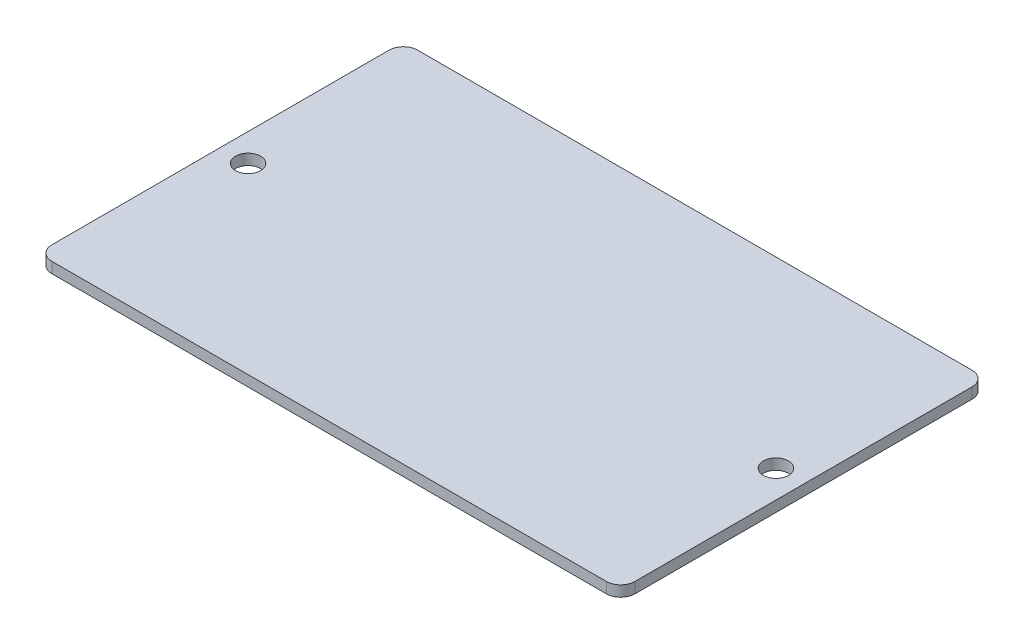
from build123d import *

# Parameters (mm, degrees)
SKETCH1_W               = 81.3
SKETCH1_H               = 51
BOSS_EXTRUDE1_DEPTH     = 1.5
FILLET1_R               = 2
CUT_EXTRUDE1_DEPTH      = 96.984061177
CUT_EXTRUDE1_DEPTH_BACK = 96.984061177
SKETCH2_R               = 1.75


with BuildPart() as part:
    # Sketch1 → Boss-Extrude1 (new body)
    with BuildSketch(Plane(origin=(0, 0, 0), x_dir=(1, 0, 0), z_dir=(0, 1, 0))):
        with Locations((40.65, 25.5)):
            Rectangle(SKETCH1_W, SKETCH1_H)
    extrude(amount=BOSS_EXTRUDE1_DEPTH)

    # Fillet1
    fillet1_edges = [part.edges().sort_by_distance(p)[0] for p in [
        (0, 0.75, -51),
        (81.3, 0.75, -51),
        (81.3, 0.75, 0),
        (0, 0.75, 0),
    ]]
    fillet(fillet1_edges, radius=FILLET1_R)

    # Sketch2 → Cut-Extrude1 (cut, two sides: drawn at the far end of the back side and taken through both)
    with BuildSketch(Plane(origin=(0, 1.5, 0), x_dir=(1, 0, 0), z_dir=(0, 1, 0)).offset(-CUT_EXTRUDE1_DEPTH_BACK)):
        with Locations(Location((3.85, 25.5, 0), (0, 0, 270))):
            Circle(SKETCH2_R)
        with Locations(Location((77.45, 25.5, 0), (0, 0, 270))):
            Circle(SKETCH2_R)
    extrude(amount=CUT_EXTRUDE1_DEPTH + CUT_EXTRUDE1_DEPTH_BACK, mode=Mode.SUBTRACT)


solid = part.part
